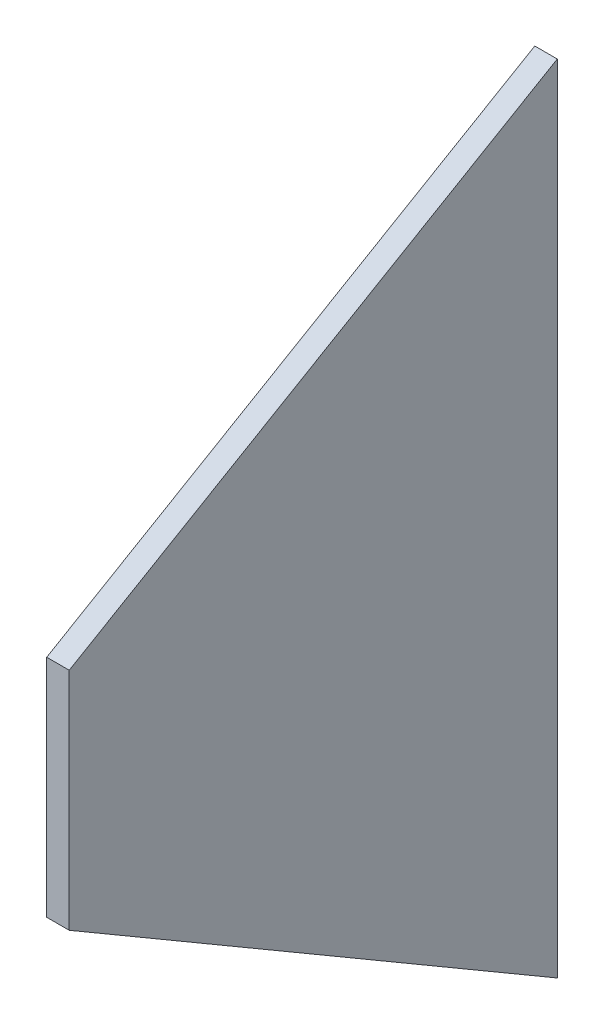
from build123d import *

# Parameters (mm, degrees)
BOSS_EXTRUDE1_DEPTH = 3


with BuildPart() as part:
    # Sketch1 → Boss-Extrude1 (new body)
    with BuildSketch(Plane.YZ):
        Polygon((0, 0), (106, 0), (68, 65), (38, 65), align=None)
    extrude(amount=BOSS_EXTRUDE1_DEPTH)


solid = part.part
